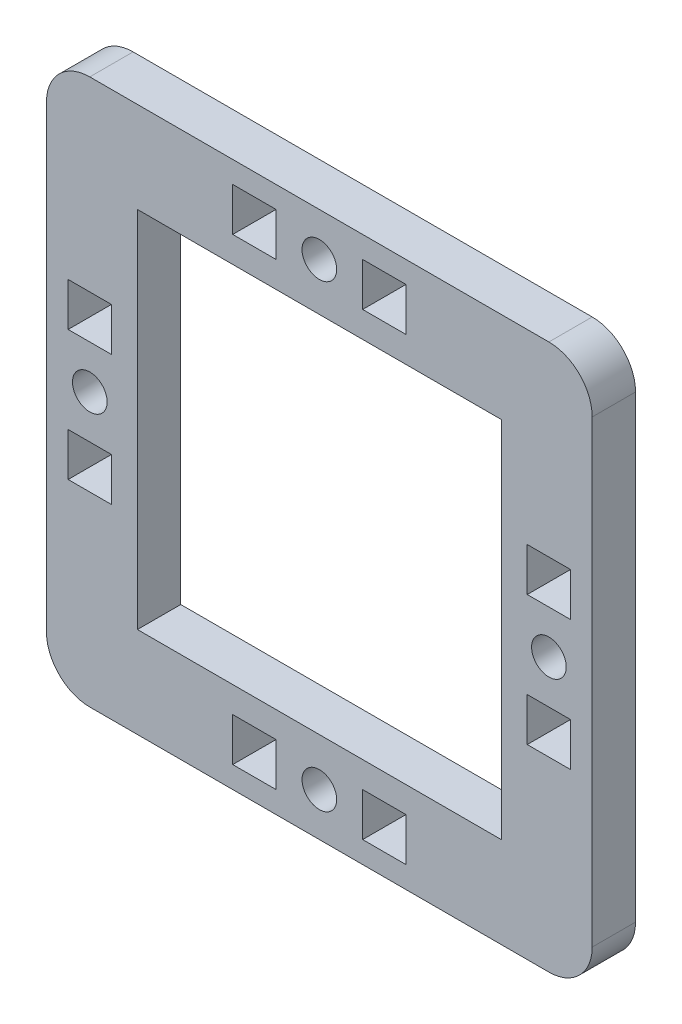
from build123d import *

# Parameters (mm, degrees)
ESQUISSE1_W        = 63
ESQUISSE1_H        = 63
ESQUISSE1_R        = 2
ESQUISSE1_W_2      = 42
ESQUISSE1_H_2      = 42
ESQUISSE1_W_3      = 5
ESQUISSE1_H_3      = 5
BOSS_EXTRU_1_DEPTH = 5
CONG_1_R           = 5


with BuildPart() as part:
    # Esquisse1 → Boss.-Extru.1 (new body)
    with BuildSketch(Plane.XY):
        Rectangle(ESQUISSE1_W, ESQUISSE1_H)
        with Locations((26.5, 0)):
            Circle(ESQUISSE1_R, mode=Mode.SUBTRACT)
        with Locations(Location((-26.5, 0, 0), (0, 0, 180))):
            Circle(ESQUISSE1_R, mode=Mode.SUBTRACT)
        with Locations(Location((0, 26.5, 0), (0, 0, 90))):
            Circle(ESQUISSE1_R, mode=Mode.SUBTRACT)
        with Locations(Location((0, -26.5, 0), (0, 0, 270))):
            Circle(ESQUISSE1_R, mode=Mode.SUBTRACT)
        Rectangle(ESQUISSE1_W_2, ESQUISSE1_H_2, mode=Mode.SUBTRACT)
        with Locations((26.5, 7.5)):
            Rectangle(ESQUISSE1_W_3, ESQUISSE1_H_3, mode=Mode.SUBTRACT)
        with Locations((26.5, -7.5)):
            Rectangle(ESQUISSE1_W_3, ESQUISSE1_H_3, mode=Mode.SUBTRACT)
        with Locations((-26.5, 7.5)):
            Rectangle(ESQUISSE1_W_3, ESQUISSE1_H_3, mode=Mode.SUBTRACT)
        with Locations((-26.5, -7.5)):
            Rectangle(ESQUISSE1_W_3, ESQUISSE1_H_3, mode=Mode.SUBTRACT)
        with Locations((7.5, 26.5)):
            Rectangle(ESQUISSE1_W_3, ESQUISSE1_H_3, mode=Mode.SUBTRACT)
        with Locations((-7.5, 26.5)):
            Rectangle(ESQUISSE1_W_3, ESQUISSE1_H_3, mode=Mode.SUBTRACT)
        with Locations((7.5, -26.5)):
            Rectangle(ESQUISSE1_W_3, ESQUISSE1_H_3, mode=Mode.SUBTRACT)
        with Locations((-7.5, -26.5)):
            Rectangle(ESQUISSE1_W_3, ESQUISSE1_H_3, mode=Mode.SUBTRACT)
    extrude(amount=BOSS_EXTRU_1_DEPTH)

    # Congé1
    cong_1_edges = [part.edges().sort_by_distance(p)[0] for p in [
        (-31.5, 31.5, 2.5),
        (31.5, 31.5, 2.5),
        (31.5, -31.5, 2.5),
        (-31.5, -31.5, 2.5),
    ]]
    fillet(cong_1_edges, radius=CONG_1_R)


solid = part.part
